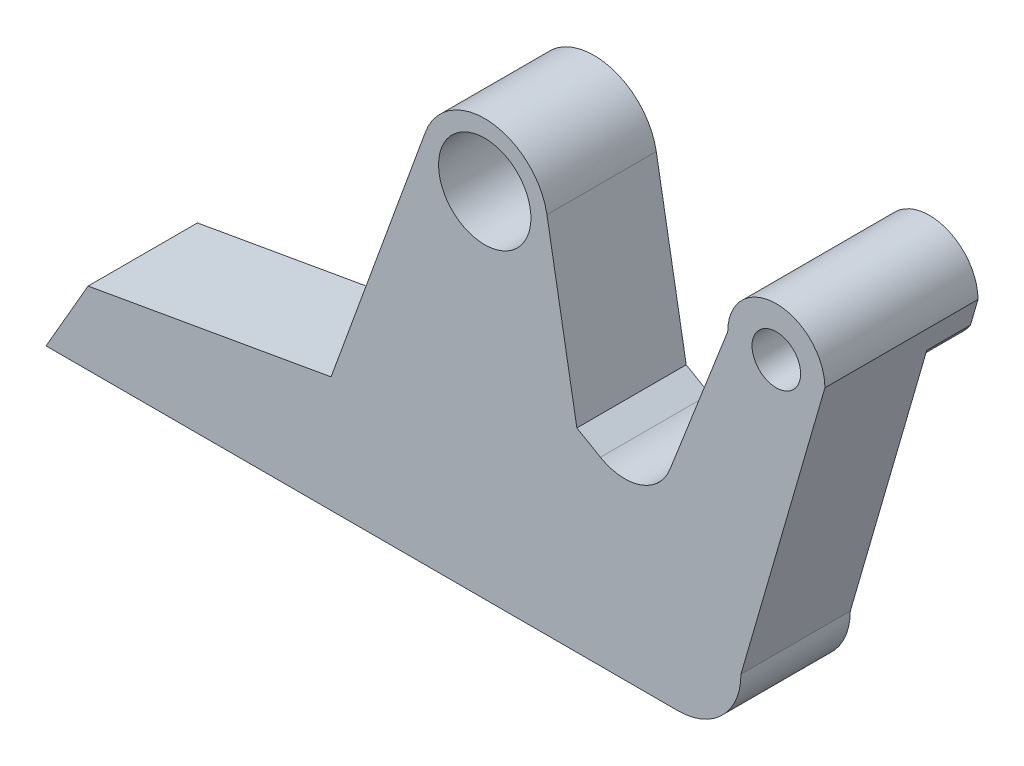
from build123d import *

# Parameters (mm, degrees)
SKETCH1_R           = 13
SKETCH1_R_2         = 9.5
SKETCH1_R_3         = 5
BOSS_EXTRUDE1_DEPTH = 22.5
SKETCH6_W           = 3
SKETCH6_H           = 3
CUT_EXTRUDE2_DEPTH  = 130
FILLET1_R           = 10
SKETCH7_R           = 5
BOSS_EXTRUDE2_DEPTH = 9


with BuildPart() as part:
    # Sketch1 → Boss-Extrude1 (new body)
    # profile 1 of 7: a face of its own
    with BuildSketch(Plane.XY):
        with BuildLine():
            ThreePointArc((103.274249999, 72.665631876), (88.01682369, 59.863131087), (78.058245929, 77.11189374))
            Line((78.058245929, 77.11189374), (58.660254038, 23.816349035))
            Line((58.660254038, 23.816349035), (8.660254038, 15))
            Line((8.660254038, 15), (0, 0))
            Line((0, 0), (130, 0))
            ThreePointArc((130, 0), (120.807611845, 3.807611845), (117, 13))
            ThreePointArc((117, 13), (117.888810571, 17.724308479), (120.433706247, 21.802614602))
            Line((120.433706247, 21.802614602), (124.168764572, 31.377772343))
            Line((124.168764572, 31.377772343), (109.234628196, 40))
            Line((109.234628196, 40), (103.076750789, 74.923058186))
            ThreePointArc((103.076750789, 74.923058186), (103.224781075, 73.798656532), (103.274249999, 72.665631876))
        make_face()
    # profile 2 of 7: a face of its own
    with BuildSketch(Plane.XY):
        with Locations((90.274249999, 72.665631876)):
            Circle(SKETCH1_R)
        with Locations(Location((90.274249999, 72.665631876, 0), (0, 0, 180))):
            Circle(SKETCH1_R_2, mode=Mode.SUBTRACT)
    # profile 3 of 7: a face of its own
    with BuildSketch(Plane.XY):
        with BuildLine():
            Line((136.5, 24.258330249), (124.168764572, 31.377772343))
            Line((124.168764572, 31.377772343), (120.433706247, 21.802614602))
            ThreePointArc((120.433706247, 21.802614602), (128.035776443, 25.850751955), (136.5, 24.258330249))
        make_face()
    # profile 4 of 7: a face of its own
    with BuildSketch(Plane.XY):
        with BuildLine():
            ThreePointArc((117, 13), (120.807611845, 3.807611845), (130, 0))
            ThreePointArc((130, 0), (139.192388155, 3.807611845), (143, 13))
            ThreePointArc((143, 13), (141.258330249, 19.5), (136.5, 24.258330249))
            ThreePointArc((136.5, 24.258330249), (128.035776443, 25.850751955), (120.433706247, 21.802614602))
            Line((120.433706247, 21.802614602), (117, 13))
        make_face()
    # profile 5 of 7: a face of its own
    with BuildSketch(Plane.XY):
        with BuildLine():
            Line((117, 13), (120.433706247, 21.802614602))
            ThreePointArc((120.433706247, 21.802614602), (117.888810571, 17.724308479), (117, 13))
        make_face()
    # profile 6 of 7: a face of its own
    with BuildSketch(Plane.XY):
        with BuildLine():
            Line((140.274249999, 72.665631876), (124.168764572, 31.377772343))
            Line((124.168764572, 31.377772343), (136.5, 24.258330249))
            ThreePointArc((136.5, 24.258330249), (141.258330249, 19.5), (143, 13))
            Line((143, 13), (158.72749128, 67.323093917))
            ThreePointArc((158.72749128, 67.323093917), (147.493280097, 63.060101886), (140.274249999, 72.665631876))
        make_face()
    # profile 7 of 7: a face of its own
    with BuildSketch(Plane.XY):
        with BuildLine():
            ThreePointArc((160.274249999, 72.665631876), (150.274249999, 82.665631876), (140.274249999, 72.665631876))
            ThreePointArc((140.274249999, 72.665631876), (147.493280097, 63.060101886), (158.72749128, 67.323093917))
            Line((158.72749128, 67.323093917), (160.274249999, 72.665631876))
        make_face()
        with Locations(Location((150.274249999, 72.665631876, 0), (0, 0, 180))):
            Circle(SKETCH1_R_3, mode=Mode.SUBTRACT)
    extrude(amount=BOSS_EXTRUDE1_DEPTH)

    # Sketch6 → Cut-Extrude2 (cut)
    with BuildSketch(Plane(origin=(0, 0, 0), x_dir=(0, 0, -1), z_dir=(-1, 0, 0))):
        with Locations((-9.75, -1.5)):
            Rectangle(SKETCH6_W, SKETCH6_H)
        Polygon((-8.25, -3), (-11.25, -3), (-11.25, -6), (-5.25, -6), (-5.25, -3), align=None)
        with Locations((-12.75, -1.5)):
            Rectangle(SKETCH6_W, SKETCH6_H)
        Polygon((-11.25, -3), (-14.25, -3), (-17.25, -3), (-17.25, -6), (-11.25, -6), align=None)
    extrude(amount=-CUT_EXTRUDE2_DEPTH, mode=Mode.SUBTRACT)

    # Fillet1
    fillet1_edges = [part.edges().sort_by_distance(p)[0] for p in [
        (124.168764572, 31.377772343, 11.25),
    ]]
    fillet(fillet1_edges, radius=FILLET1_R)

    # Sketch7 → Boss-Extrude2 (add)
    with BuildSketch(Plane.XY.offset(22.5)):
        with BuildLine():
            Line((158.72749128, 67.323093917), (160.274249999, 72.665631876))
            ThreePointArc((160.274249999, 72.665631876), (150.274249999, 82.665631876), (140.274249999, 72.665631876))
            ThreePointArc((140.274249999, 72.665631876), (147.493280097, 63.060101886), (158.72749128, 67.323093917))
        make_face()
        with Locations(Location((150.274249999, 72.665631876, 0), (0, 0, 180))):
            Circle(SKETCH7_R, mode=Mode.SUBTRACT)
    extrude(amount=BOSS_EXTRUDE2_DEPTH)


with BuildPart() as body_2:
    # Mirror1: mirrored copy
    add(part.part.mirror(Plane.XY))


solid = body_2.part
